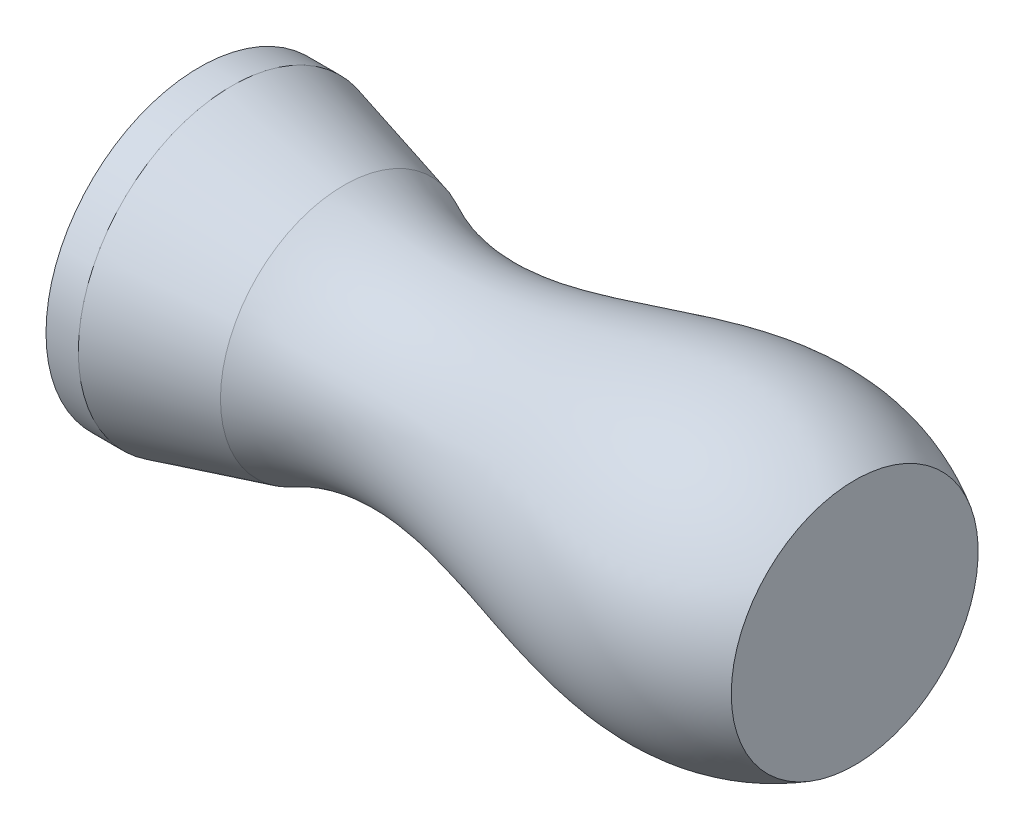
from build123d import *


with BuildPart() as part:
    # 草圖1 → 旋轉1 (revolve)
    with BuildSketch(Plane.XY, mode=Mode.PRIVATE) as revolve_1_sk:
        with BuildLine():
            Line((0, 0), (0, 145.873745228))
            Line((0, 145.873745228), (30.745324906, 145.873745228))
            Line((30.745324906, 145.873745228), (137.48221184, 117.410575379))
            add(Edge.make_bspline(
                [(137.48221184, 117.410575379), (298.066617212, 35.962407985), (457.050125006, 212.541472347), (623.389181847, 117.410575691)],
                knots=[0, 0, 0, 0, 1, 1, 1, 1], degree=3))
            Line((623.389181847, 117.410575691), (623.389181847, 0))
            Line((623.389181847, 0), (0, 0))
        make_face()
    revolve(revolve_1_sk.sketch.rotate(Axis((0, 0, 0), (1, 0, 0)), 90), axis=Axis((0, 0, 0), (1, 0, 0)))


solid = part.part
